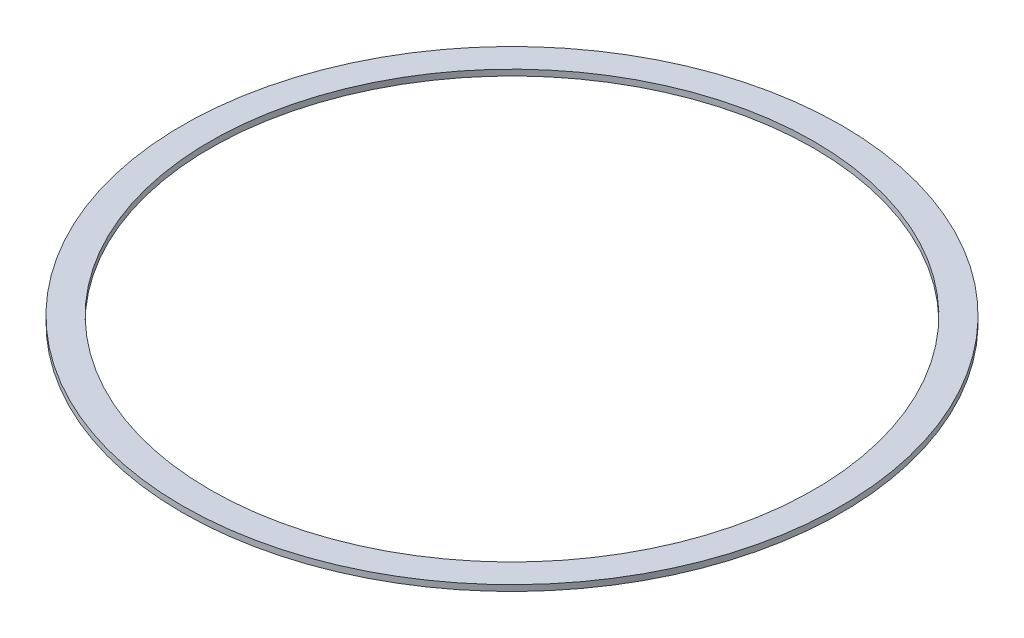
from build123d import *

# Parameters (mm, degrees)
SKETCH_1_W = 9.345
SKETCH_1_H = 2


with BuildPart() as part:
    # Эскиз1 → Повернуть1 (revolve)
    with BuildSketch(Plane.XY):
        with Locations((106.3625, 0)):
            Rectangle(SKETCH_1_W, SKETCH_1_H)
    revolve(axis=Axis((0, 12.961559514, 0), (0, -1, 0)))


solid = part.part
